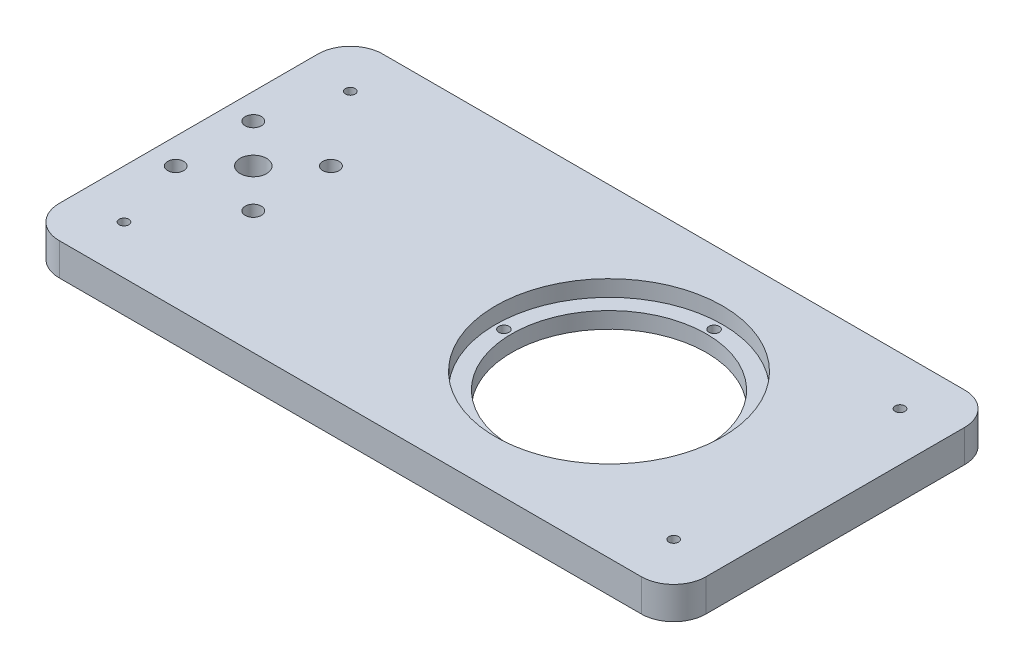
from build123d import *

# Parameters (mm, degrees)
SKETCH_1_W          = 200
SKETCH_1_H          = 100
EXTRUDE_1_DEPTH     = 10
SKETCH_2_R          = 2.5
SKETCH_2_R_2        = 30.1
SKETCH_2_R_3        = 4.1
CUT_EXTRUDE_1_DEPTH = 113.249721603
SKETCH_3_R          = 35.1
CUT_EXTRUDE_2_DEPTH = 5
FILLET_1_R          = 10
SKETCH_4_W          = 10.2
SKETCH_4_H          = 10.2
CUT_EXTRUDE_4_DEPTH = 5
SKETCH_5_R          = 1.6
CUT_EXTRUDE_5_DEPTH = 112.915146428
SKETCH_6_R          = 1.5
CUT_EXTRUDE_7_DEPTH = 113.249721603


with BuildPart() as part:
    # ｽｹｯﾁ1 → ﾎﾞｽ - 押し出し1 (new body)
    with BuildSketch(Plane(origin=(0, 0, 0), x_dir=(1, 0, 0), z_dir=(0, 1, 0))):
        Rectangle(SKETCH_1_W, SKETCH_1_H)
    extrude(amount=EXTRUDE_1_DEPTH)

    # ｽｹｯﾁ2 → ｶｯﾄ - 押し出し1 (cut, through all)
    with BuildSketch(Plane(origin=(0, 10, 0), x_dir=(1, 0, 0), z_dir=(0, 1, 0))):
        with Locations((-92, 12)):
            Circle(SKETCH_2_R)
        with Locations((-68, 12)):
            Circle(SKETCH_2_R)
        with Locations((-92, -12)):
            Circle(SKETCH_2_R)
        with Locations((-68, -12)):
            Circle(SKETCH_2_R)
        with Locations((30, 0)):
            Circle(SKETCH_2_R_2)
        with Locations((-80, 0)):
            Circle(SKETCH_2_R_3)
    extrude(amount=-CUT_EXTRUDE_1_DEPTH, mode=Mode.SUBTRACT)

    # ｽｹｯﾁ3 → ｶｯﾄ - 押し出し2 (cut)
    with BuildSketch(Plane.XZ.offset(-10)):
        with Locations((30, 0)):
            Circle(SKETCH_3_R)
    extrude(amount=CUT_EXTRUDE_2_DEPTH, mode=Mode.SUBTRACT)

    # ﾌｨﾚｯﾄ1
    fillet_1_edges = [part.edges().sort_by_distance(p)[0] for p in [
        (100, 5, -50),
        (-100, 5, -50),
        (100, 5, 50),
        (-100, 5, 50),
    ]]
    fillet(fillet_1_edges, radius=FILLET_1_R)

    # ｽｹｯﾁ4 → ｶｯﾄ - 押し出し4 (cut)
    with BuildSketch(Plane.XZ):
        with Locations((-85, 35)):
            Rectangle(SKETCH_4_W, SKETCH_4_H)
        with Locations((-85, -35)):
            Rectangle(SKETCH_4_W, SKETCH_4_H)
        with Locations((85, 35)):
            Rectangle(SKETCH_4_W, SKETCH_4_H)
        with Locations((85, -35)):
            Rectangle(SKETCH_4_W, SKETCH_4_H)
    extrude(amount=-CUT_EXTRUDE_4_DEPTH, mode=Mode.SUBTRACT)

    # ｽｹｯﾁ5 → ｶｯﾄ - 押し出し5 (cut, through all)
    with BuildSketch(Plane(origin=(0, 5, 0), x_dir=(1, 0, 0), z_dir=(0, 1, 0))):
        with Locations((-2.5, 0)):
            Circle(SKETCH_5_R)
        with Locations((62.5, 0)):
            Circle(SKETCH_5_R)
        with Locations((30, 32.5)):
            Circle(SKETCH_5_R)
        with Locations((30, -32.5)):
            Circle(SKETCH_5_R)
    extrude(amount=-CUT_EXTRUDE_5_DEPTH, mode=Mode.SUBTRACT)

    # ｽｹｯﾁ6 → ｶｯﾄ - 押し出し7 (cut, through all)
    with BuildSketch(Plane(origin=(0, 0, 0), x_dir=(1, 0, 0), z_dir=(0, 1, 0))):
        with Locations((-85, -35)):
            Circle(SKETCH_6_R)
        with Locations((-85, 35)):
            Circle(SKETCH_6_R)
        with Locations((85, 35)):
            Circle(SKETCH_6_R)
        with Locations((85, -35)):
            Circle(SKETCH_6_R)
    extrude(amount=CUT_EXTRUDE_7_DEPTH, mode=Mode.SUBTRACT)


solid = part.part
